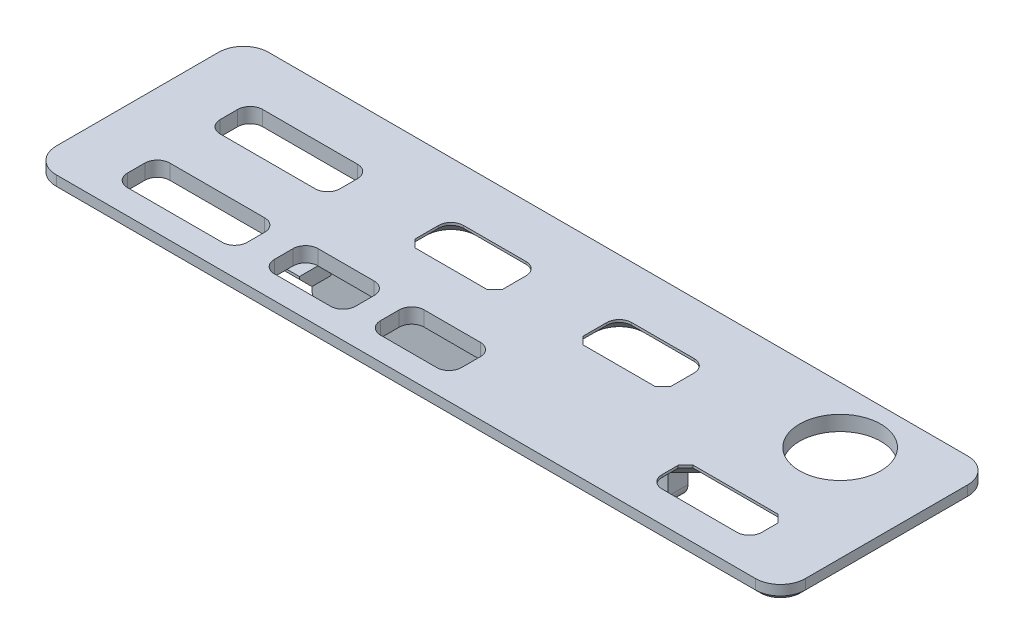
from build123d import *

# Parameters (mm, degrees)
SKETCH_1_W          = 60
SKETCH_1_H          = 17
EXTRUDE_1_DEPTH     = 1.2
CUT_EXTRUDE_1_REACH = 33.204
SKETCH_4_R          = 3.25
SKETCH_4_W          = 9.6
SKETCH_4_H          = 3.4
SKETCH_4_W_2        = 7
SKETCH_4_H_2        = 3.5
SKETCH_4_W_3        = 8
SKETCH_4_H_3        = 2.9
SKETCH_4_W_4        = 6.5
FILLET_2_R          = 1
CHAMFER_1_SIZE      = 0.6
SKETCH_5_W          = 1.5
SKETCH_5_H          = 8
EXTRUDE_2_DEPTH     = 1.2
SKETCH_6_W          = 28.5
SKETCH_6_H          = 1.6
EXTRUDE_3_DEPTH     = 4
FILLET_3_R          = 1
CHAMFER_2_SIZE      = 1
CHAMFER_4_SIZE      = 1
FILLET_4_R          = 2
CHAMFER_5_SIZE      = 0.4


with BuildPart() as part:
    # 草图1 → 凸台-拉伸1 (new body)
    with BuildSketch(Plane(origin=(0, 0, 0), x_dir=(1, 0, 0), z_dir=(0, 1, 0))):
        Rectangle(SKETCH_1_W, SKETCH_1_H)
    extrude(amount=EXTRUDE_1_DEPTH)

    # 草图4 → 切除-拉伸1 (cut, up to next)
    with BuildSketch(Plane(origin=(0, 1.2, 0), x_dir=(1, 0, 0), z_dir=(0, 1, 0)), mode=Mode.PRIVATE) as cut_extrude_1_sk1:
        with Locations(Location((22.298485985, 3.98318929, 0), (0, 0, 270))):
            Circle(SKETCH_4_R)
    cut_extrude_1_tool1 = extrude(cut_extrude_1_sk1.sketch, amount=-CUT_EXTRUDE_1_REACH, mode=Mode.PRIVATE) & part.part
    # 草图4 → 切除-拉伸1 (cut, up to next)
    with BuildSketch(Plane(origin=(0, 1.2, 0), x_dir=(1, 0, 0), z_dir=(0, 1, 0)), mode=Mode.PRIVATE) as cut_extrude_1_sk2:
        with Locations((-20.471722325, 2.6)):
            Rectangle(SKETCH_4_W, SKETCH_4_H)
    cut_extrude_1_tool2 = extrude(cut_extrude_1_sk2.sketch, amount=-CUT_EXTRUDE_1_REACH, mode=Mode.PRIVATE) & part.part
    # 草图4 → 切除-拉伸1 (cut, up to next)
    with BuildSketch(Plane(origin=(0, 1.2, 0), x_dir=(1, 0, 0), z_dir=(0, 1, 0)), mode=Mode.PRIVATE) as cut_extrude_1_sk3:
        with Locations((-5.682926277, 2.55)):
            Rectangle(SKETCH_4_W_2, SKETCH_4_H_2)
    cut_extrude_1_tool3 = extrude(cut_extrude_1_sk3.sketch, amount=-CUT_EXTRUDE_1_REACH, mode=Mode.PRIVATE) & part.part
    # 草图4 → 切除-拉伸1 (cut, up to next)
    with BuildSketch(Plane(origin=(0, 1.2, 0), x_dir=(1, 0, 0), z_dir=(0, 1, 0)), mode=Mode.PRIVATE) as cut_extrude_1_sk4:
        with Locations((7.788485985, 2.55)):
            Rectangle(SKETCH_4_W_2, SKETCH_4_H_2)
    cut_extrude_1_tool4 = extrude(cut_extrude_1_sk4.sketch, amount=-CUT_EXTRUDE_1_REACH, mode=Mode.PRIVATE) & part.part
    # 草图4 → 切除-拉伸1 (cut, up to next)
    with BuildSketch(Plane(origin=(0, 1.2, 0), x_dir=(1, 0, 0), z_dir=(0, 1, 0)), mode=Mode.PRIVATE) as cut_extrude_1_sk5:
        with Locations((21.05, -4.584803861)):
            Rectangle(SKETCH_4_W_3, SKETCH_4_H_3)
    cut_extrude_1_tool5 = extrude(cut_extrude_1_sk5.sketch, amount=-CUT_EXTRUDE_1_REACH, mode=Mode.PRIVATE) & part.part
    # 草图4 → 切除-拉伸1 (cut, up to next)
    with BuildSketch(Plane(origin=(0, 1.2, 0), x_dir=(1, 0, 0), z_dir=(0, 1, 0)), mode=Mode.PRIVATE) as cut_extrude_1_sk6:
        with Locations((-1.65, -4.884803861)):
            Rectangle(SKETCH_4_W_4, SKETCH_4_H_2)
    cut_extrude_1_tool6 = extrude(cut_extrude_1_sk6.sketch, amount=-CUT_EXTRUDE_1_REACH, mode=Mode.PRIVATE) & part.part
    # 草图4 → 切除-拉伸1 (cut, up to next)
    with BuildSketch(Plane(origin=(0, 1.2, 0), x_dir=(1, 0, 0), z_dir=(0, 1, 0)), mode=Mode.PRIVATE) as cut_extrude_1_sk7:
        with Locations((-10.15, -4.884803861)):
            Rectangle(SKETCH_4_W_4, SKETCH_4_H_2)
    cut_extrude_1_tool7 = extrude(cut_extrude_1_sk7.sketch, amount=-CUT_EXTRUDE_1_REACH, mode=Mode.PRIVATE) & part.part
    # 草图4 → 切除-拉伸1 (cut, up to next)
    with BuildSketch(Plane(origin=(0, 1.2, 0), x_dir=(1, 0, 0), z_dir=(0, 1, 0)), mode=Mode.PRIVATE) as cut_extrude_1_sk8:
        with Locations((-20.471722325, -4.834803861)):
            Rectangle(SKETCH_4_W, SKETCH_4_H)
    cut_extrude_1_tool8 = extrude(cut_extrude_1_sk8.sketch, amount=-CUT_EXTRUDE_1_REACH, mode=Mode.PRIVATE) & part.part
    add(cut_extrude_1_tool1.solids().sort_by_distance((22.298486, 1.2, -3.983189))[0], mode=Mode.SUBTRACT)
    add(cut_extrude_1_tool2.solids().sort_by_distance((-20.471722, 1.2, -2.6))[0], mode=Mode.SUBTRACT)
    add(cut_extrude_1_tool3.solids().sort_by_distance((-5.682926, 1.2, -2.55))[0], mode=Mode.SUBTRACT)
    add(cut_extrude_1_tool4.solids().sort_by_distance((7.788486, 1.2, -2.55))[0], mode=Mode.SUBTRACT)
    add(cut_extrude_1_tool5.solids().sort_by_distance((21.05, 1.2, 4.584804))[0], mode=Mode.SUBTRACT)
    add(cut_extrude_1_tool6.solids().sort_by_distance((-1.65, 1.2, 4.884804))[0], mode=Mode.SUBTRACT)
    add(cut_extrude_1_tool7.solids().sort_by_distance((-10.15, 1.2, 4.884804))[0], mode=Mode.SUBTRACT)
    add(cut_extrude_1_tool8.solids().sort_by_distance((-20.471722, 1.2, 4.834804))[0], mode=Mode.SUBTRACT)

    # 圆角2
    fillet_2_edges = [part.edges().sort_by_distance(p)[0] for p in [
        (-9.182926277, 0.6, -4.3),
        (-2.182926277, 0.6, -4.3),
        (4.288485985, 0.6, -4.3),
        (11.288485985, 0.6, -4.3),
        (17.05, 0.6, 6.034803861),
        (25.05, 0.6, 6.034803861),
        (-4.9, 0.6, 6.634803861),
        (-4.9, 0.6, 3.134803861),
        (1.6, 0.6, 3.134803861),
        (1.6, 0.6, 6.634803861),
        (-13.4, 0.6, 6.634803861),
        (-13.4, 0.6, 3.134803861),
        (-6.9, 0.6, 3.134803861),
        (-6.9, 0.6, 6.634803861),
        (-25.271722325, 0.6, 6.534803861),
        (-25.271722325, 0.6, 3.134803861),
        (-15.671722325, 0.6, 3.134803861),
        (-15.671722325, 0.6, 6.534803861),
        (-25.271722325, 0.6, -0.9),
        (-25.271722325, 0.6, -4.3),
        (-15.671722325, 0.6, -4.3),
        (-15.671722325, 0.6, -0.9),
    ]]
    fillet(fillet_2_edges, radius=FILLET_2_R)

    # 倒角1
    chamfer_1_edges = [part.edges().sort_by_distance(p)[0] for p in [
        (-9.182926277, 0.6, -0.8),
        (-2.182926277, 0.6, -0.8),
        (4.288485985, 0.6, -0.8),
        (11.288485985, 0.6, -0.8),
        (17.05, 0.6, 3.134803861),
        (25.05, 0.6, 3.134803861),
    ]]
    chamfer(chamfer_1_edges, length=CHAMFER_1_SIZE)

    # 草图5 → 凸台-拉伸2 (add)
    with BuildSketch(Plane.XZ):
        with Locations((-13.15891381, 0.61681071)):
            Rectangle(SKETCH_5_W, SKETCH_5_H)
        with Locations((13.84108619, 0.61681071)):
            Rectangle(SKETCH_5_W, SKETCH_5_H)
    extrude(amount=EXTRUDE_2_DEPTH)

    # 草图6 → 凸台-拉伸3 (add)
    with BuildSketch(Plane.XZ):
        with Locations((0.34108619, 1.3)):
            Rectangle(SKETCH_6_W, SKETCH_6_H)
    extrude(amount=EXTRUDE_3_DEPTH)

    # 圆角3
    fillet_3_edges = [part.edges().sort_by_distance(p)[0] for p in [
        (-13.90891381, -4, 1.3),
        (14.59108619, -4, 1.3),
    ]]
    fillet(fillet_3_edges, radius=FILLET_3_R)

    # 倒角2
    chamfer_2_edges = [part.edges().sort_by_distance(p)[0] for p in [
        (-13.15891381, -1.2, -3.38318929),
        (-13.15891381, -1.2, 4.61681071),
        (13.84108619, -1.2, -3.38318929),
        (13.84108619, -1.2, 4.61681071),
    ]]
    chamfer(chamfer_2_edges, length=CHAMFER_2_SIZE)

    # 倒角4
    chamfer_4_edges = [part.edges().sort_by_distance(p)[0] for p in [
        (-5.682926277, 0, -4.3),
        (-2.182926277, 0, -2.35),
        (7.788485985, 0, -4.3),
        (11.288485985, 0, -2.35),
        (21.05, 0, 6.034803861),
        (17.05, 0, 4.384803861),
        (-2.475819496, 0, -4.007106781),
        (-8.890033058, 0, -4.007106781),
        (4.581379204, 0, -4.007106781),
        (10.995592766, 0, -4.007106781),
        (24.757106781, 0, 5.741910642),
        (17.342893219, 0, 5.741910642),
        (-5.682926277, 0, -0.8),
        (-9.182926277, 0, -2.35),
        (7.788485985, 0, -0.8),
        (4.288485985, 0, -2.35),
        (21.05, 0, 3.134803861),
        (25.05, 0, 4.384803861),
        (-8.882926277, 0, -1.1),
        (-2.482926277, 0, -1.1),
        (4.588485985, 0, -1.1),
        (10.988485985, 0, -1.1),
        (17.35, 0, 3.434803861),
        (24.75, 0, 3.434803861),
    ]]
    chamfer(chamfer_4_edges, length=CHAMFER_4_SIZE)

    # 圆角4
    fillet_4_edges = [part.edges().sort_by_distance(p)[0] for p in [
        (30, 0.6, 8.5),
        (-30, 0.6, 8.5),
        (-30, 0.6, -8.5),
        (30, 0.6, -8.5),
    ]]
    fillet(fillet_4_edges, radius=FILLET_4_R)

    # 倒角5
    chamfer_5_edges = [part.edges().sort_by_distance(p)[0] for p in [
        (30, 0, 0),
        (0, 0, 8.5),
        (-30, 0, 0),
        (0, 0, -8.5),
        (-29.414213562, 0, -7.914213562),
        (-29.414213562, 0, 7.914213562),
        (29.414213562, 0, -7.914213562),
        (29.414213562, 0, 7.914213562),
    ]]
    chamfer(chamfer_5_edges, length=CHAMFER_5_SIZE)


solid = part.part
